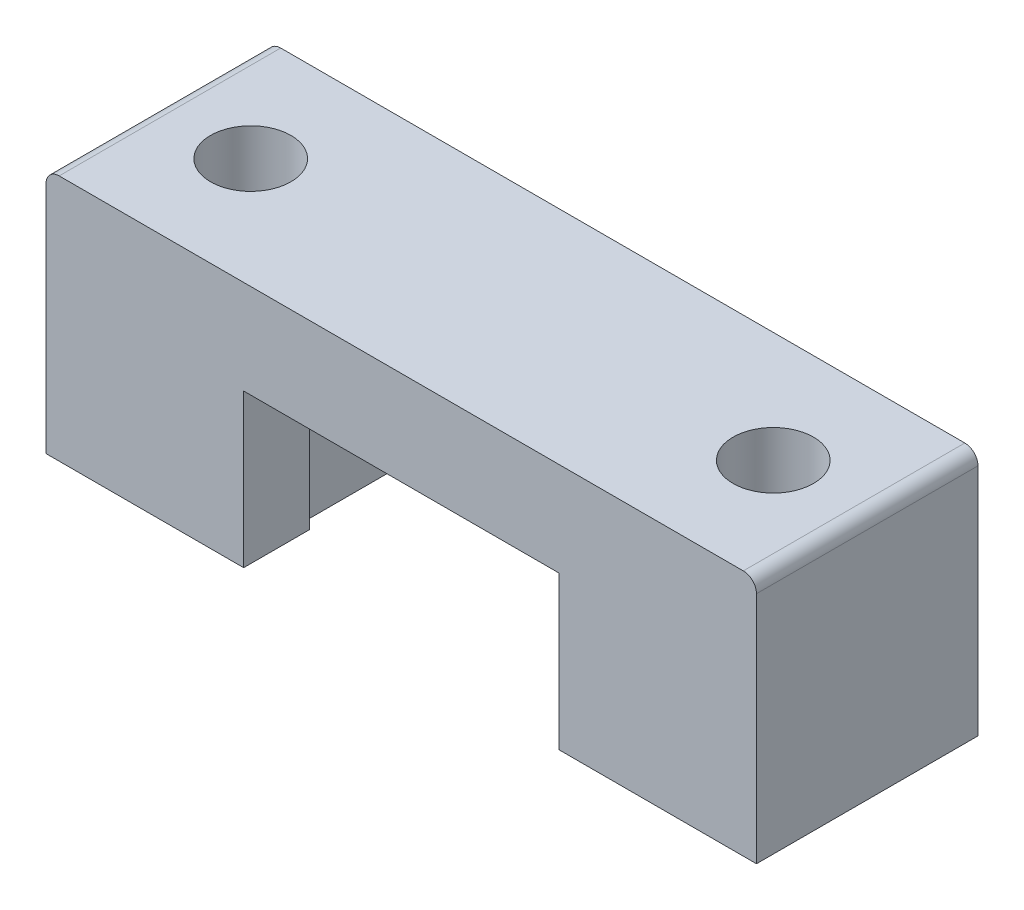
from build123d import *

# Parameters (mm, degrees)
SKETCH1_R           = 1.55
BOSS_EXTRUDE1_DEPTH = 9.525
CUT_EXTRUDE1_DEPTH  = 5.9
FILLET1_R           = 0.508


with BuildPart() as part:
    # Sketch1 → Boss-Extrude1 (new body)
    # profile 1 of 5: a face of its own
    with BuildSketch(Plane(origin=(0, 0, 0), x_dir=(1, 0, 0), z_dir=(0, 1, 0))):
        Polygon((0, -6), (0, 0), (-7.245, 0), (-7.245, -8.54), (0.375, -8.54), (0.375, -6), align=None)
        with Locations(Location((-3.6225, -4.27, 0), (0, 0, 90))):
            Circle(SKETCH1_R, mode=Mode.SUBTRACT)
    # profile 2 of 5: a face of its own
    with BuildSketch(Plane(origin=(0, 0, 0), x_dir=(1, 0, 0), z_dir=(0, 1, 0))):
        Polygon((12.9, -6), (12.9, 0), (0, 0), (0, -6), (0.375, -6), (0.375, -8.54), (12.525, -8.54), (12.525, -6), align=None)
    # profile 3 of 5: a face of its own
    with BuildSketch(Plane(origin=(0, 0, 0), x_dir=(1, 0, 0), z_dir=(0, 1, 0))):
        Polygon((20.145, 0), (12.9, 0), (12.9, -6), (12.525, -6), (12.525, -8.54), (20.145, -8.54), align=None)
        with Locations(Location((16.5225, -4.27, 0), (0, 0, 90))):
            Circle(SKETCH1_R, mode=Mode.SUBTRACT)
    # profile 4 of 5: a face of its own
    with BuildSketch(Plane(origin=(0, 0, 0), x_dir=(1, 0, 0), z_dir=(0, 1, 0))):
        Polygon((0, -6), (0, 0), (-7.245, 0), (-7.245, -8.54), (0.375, -8.54), (0.375, -6), align=None)
        with Locations(Location((-3.6225, -4.27, 0), (0, 0, 90))):
            Circle(SKETCH1_R, mode=Mode.SUBTRACT)
    # profile 5 of 5: a face of its own
    with BuildSketch(Plane(origin=(0, 0, 0), x_dir=(1, 0, 0), z_dir=(0, 1, 0))):
        Polygon((20.145, 0), (12.9, 0), (12.9, -6), (12.525, -6), (12.525, -8.54), (20.145, -8.54), align=None)
        with Locations(Location((16.5225, -4.27, 0), (0, 0, 90))):
            Circle(SKETCH1_R, mode=Mode.SUBTRACT)
    extrude(amount=BOSS_EXTRUDE1_DEPTH)

    # Sketch1<4> → Cut-Extrude1 (cut)
    with BuildSketch(Plane(origin=(0, 0, 0), x_dir=(1, 0, 0), z_dir=(0, 1, 0))):
        Polygon((12.9, -6), (12.9, 0), (0, 0), (0, -6), (0.375, -6), (0.375, -8.54), (12.525, -8.54), (12.525, -6), align=None)
    extrude(amount=CUT_EXTRUDE1_DEPTH, mode=Mode.SUBTRACT)

    # Fillet1
    fillet1_edges = [part.edges().sort_by_distance(p)[0] for p in [
        (-7.245, 9.525, 4.27),
        (20.145, 9.525, 4.27),
    ]]
    fillet(fillet1_edges, radius=FILLET1_R)


solid = part.part
